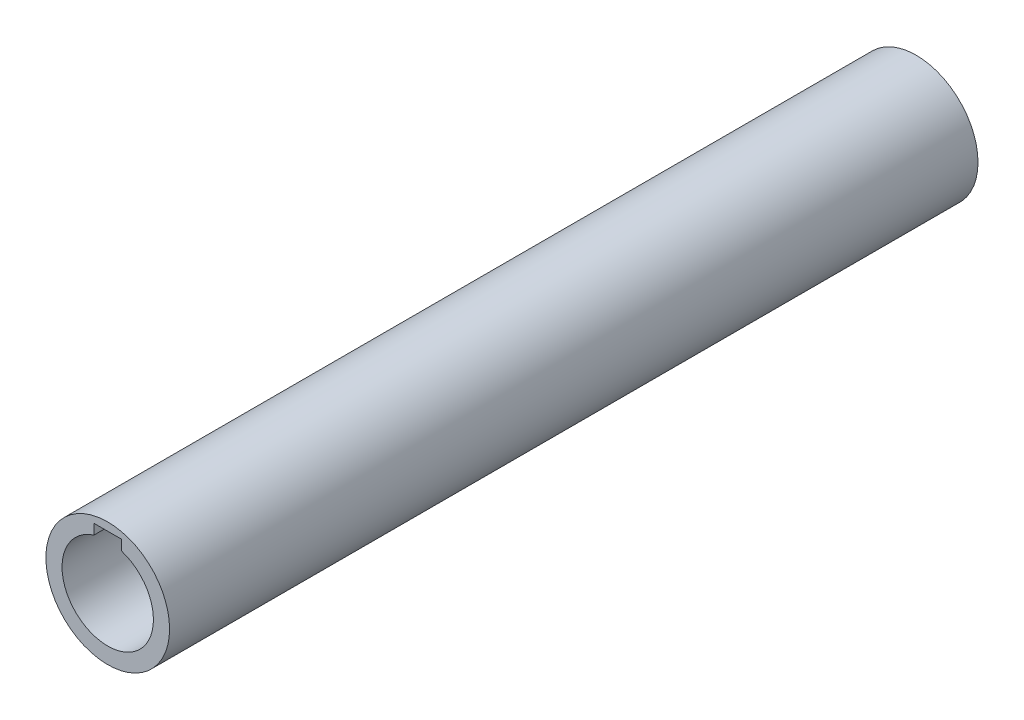
from build123d import *

# Parameters (mm, degrees)
SKETCH1_R           = 38.25
BOSS_EXTRUDE1_DEPTH = 250
CUT_EXTRUDE2_DEPTH  = 50


with BuildPart() as part:
    # Sketch1 → Boss-Extrude1 (new body)
    with BuildSketch(Plane.XY):
        Circle(SKETCH1_R)
    boss_extrude1 = extrude(amount=BOSS_EXTRUDE1_DEPTH)

    # Sketch3 → Cut-Extrude2 (cut)
    with BuildSketch(Plane.XY.offset(250)):
        with BuildLine():
            Line((-8.5, 26.940907557), (-8.5, 33.25))
            Line((-8.5, 33.25), (8.5, 33.25))
            Line((8.5, 33.25), (8.5, 26.940907557))
            ThreePointArc((8.5, 26.940907557), (0, -28.25), (-8.5, 26.940907557))
        make_face()
    cut_extrude2 = extrude(amount=-CUT_EXTRUDE2_DEPTH, mode=Mode.SUBTRACT)

    # Mirror1: Boss-Extrude1, Cut-Extrude2 across plane
    add(boss_extrude1.mirror(Plane.XY))
    add(cut_extrude2.mirror(Plane.XY), mode=Mode.SUBTRACT)


solid = part.part
